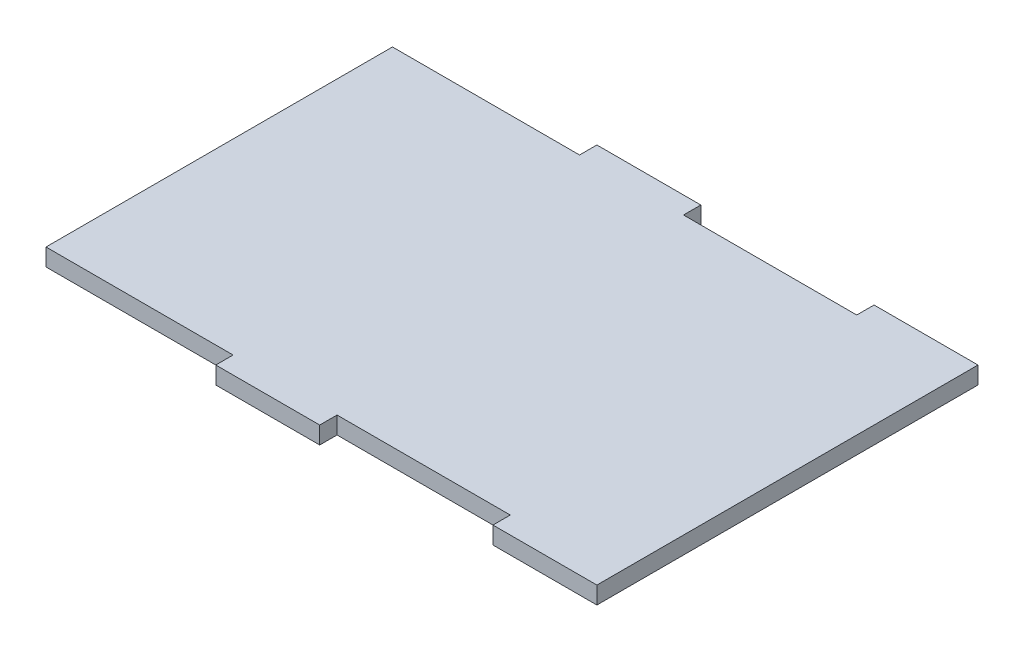
from build123d import *

# Parameters (mm, degrees)
BOSS_EXTRUDE1_DEPTH = 3.175


with BuildPart() as part:
    # Sketch1 → Boss-Extrude1 (new body)
    with BuildSketch(Plane(origin=(0, 0, 0), x_dir=(1, 0, 0), z_dir=(0, 1, 0))):
        Polygon((104.14, 63.5), (104.14, 66.675), (85.09, 66.675), (85.09, 63.5), (53.34, 63.5), (53.34, 66.675), (34.29, 66.675), (34.29, 63.5), (0, 63.5), (0, 0), (34.29, 0), (34.29, -3.175), (53.34, -3.175), (53.34, 0), (85.09, 0), (85.09, -3.175), (104.14, -3.175), (104.14, 0), align=None)
    extrude(amount=BOSS_EXTRUDE1_DEPTH)


solid = part.part
